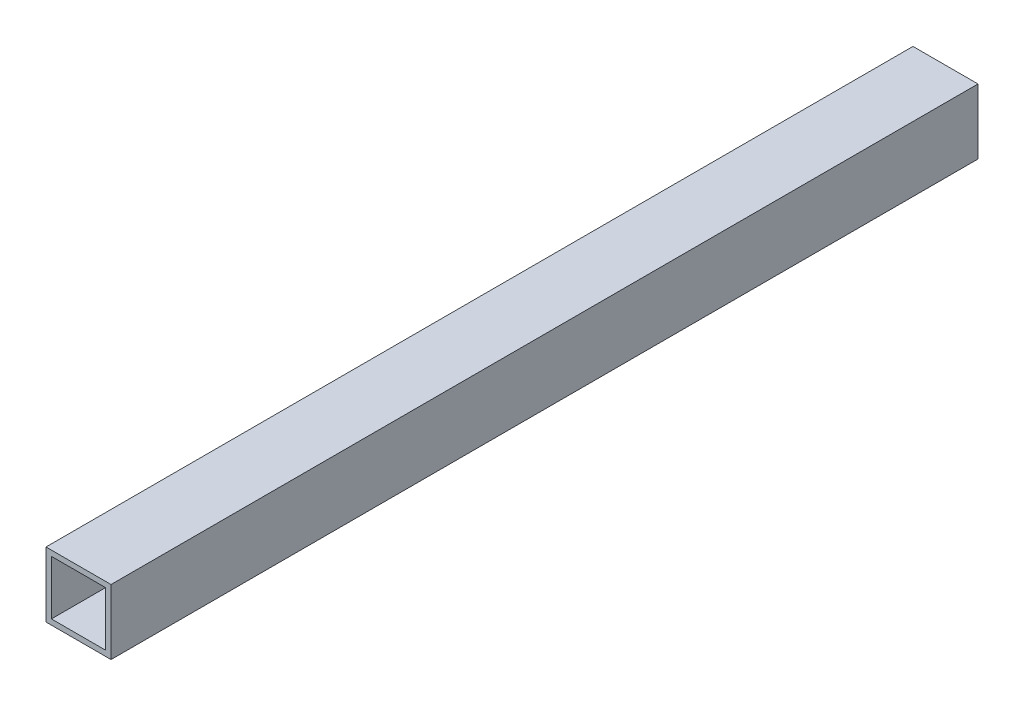
from build123d import *

# Parameters (mm, degrees)
BOSS_EXTRUDE1_DEPTH      = 254
BOSS_EXTRUDE1_DEPTH_BACK = 254
SKETCH3_W                = 38.1
SKETCH3_H                = 38.1
SKETCH3_W_2              = 31.75
SKETCH3_H_2              = 31.75


with BuildPart() as part:
    # Sketch3 → Boss-Extrude1 (new, two sides: drawn at the far end of the back side and taken through both)
    with BuildSketch(Plane.XY.offset(-BOSS_EXTRUDE1_DEPTH_BACK)):
        Rectangle(SKETCH3_W, SKETCH3_H)
        Rectangle(SKETCH3_W_2, SKETCH3_H_2, mode=Mode.SUBTRACT)
    extrude(amount=BOSS_EXTRUDE1_DEPTH + BOSS_EXTRUDE1_DEPTH_BACK)


solid = part.part
